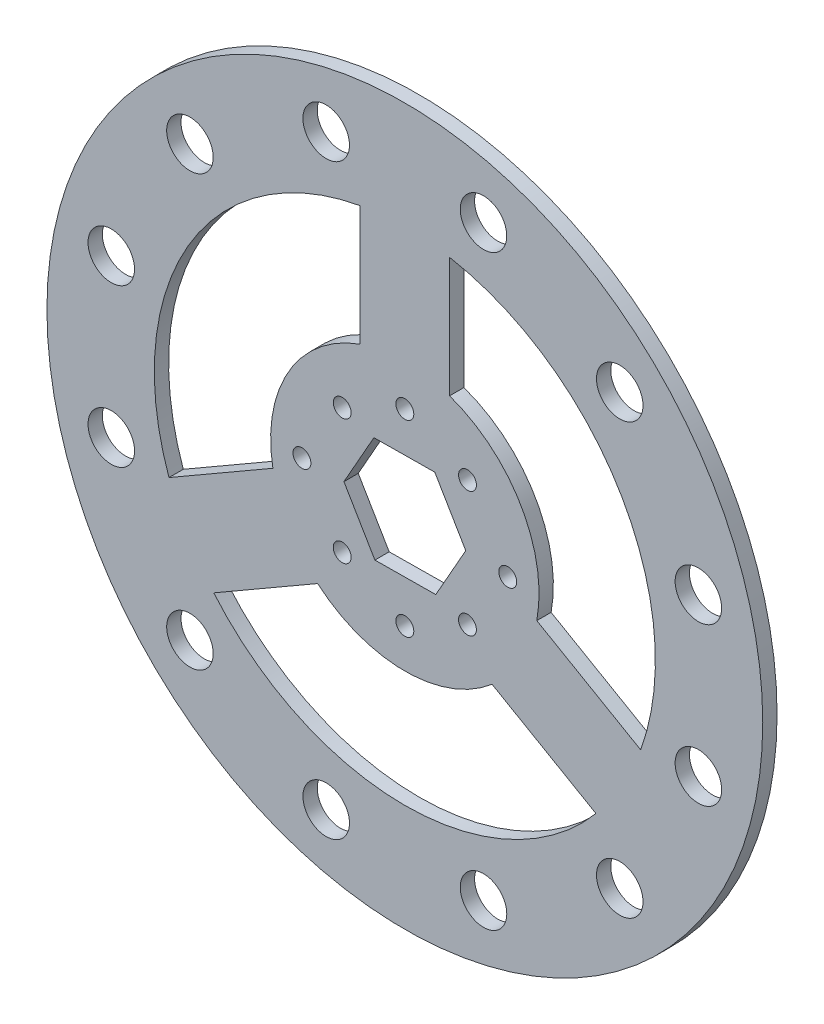
from build123d import *

# Parameters (mm, degrees)
SKETCH_8_R      = 40
SKETCH_8_R_2    = 1
SKETCH_8_R_3    = 2.6
EXTRUDE_3_DEPTH = 1.6


with BuildPart() as part:
    # 草图8 → 凸台-拉伸3 (new body)
    with BuildSketch(Plane.XY):
        with Locations((-53.736575471, -2.872479928)):
            Circle(SKETCH_8_R)
        with Locations((-53.736575471, 7.500392818)):
            Circle(SKETCH_8_R_2, mode=Mode.SUBTRACT)
        with Locations((-46.735230698, 4.127771963)):
            Circle(SKETCH_8_R_2, mode=Mode.SUBTRACT)
        with Locations((-42.236448471, -2.999480182)):
            Circle(SKETCH_8_R_2, mode=Mode.SUBTRACT)
        with Locations((-46.737760534, -9.869682445)):
            Circle(SKETCH_8_R_2, mode=Mode.SUBTRACT)
        with Locations((-53.736575471, -13.499607182)):
            Circle(SKETCH_8_R_2, mode=Mode.SUBTRACT)
        with Locations((-60.737570724, -9.872335788)):
            Circle(SKETCH_8_R_2, mode=Mode.SUBTRACT)
        with Locations((-65.236448471, -2.999480182)):
            Circle(SKETCH_8_R_2, mode=Mode.SUBTRACT)
        with Locations((-60.73580463, 4.12809202)):
            Circle(SKETCH_8_R_2, mode=Mode.SUBTRACT)
        with Locations((-62.528088914, 29.934409619)):
            Circle(SKETCH_8_R_3, mode=Mode.SUBTRACT)
        with Locations((-44.946804677, 29.93487656)):
            Circle(SKETCH_8_R_3, mode=Mode.SUBTRACT)
        with Locations((-29.720732426, 21.144638825)):
            Circle(SKETCH_8_R_3, mode=Mode.SUBTRACT)
        with Locations((-20.929685924, 5.919033515)):
            Circle(SKETCH_8_R_3, mode=Mode.SUBTRACT)
        with Locations((-20.929218983, -11.662250722)):
            Circle(SKETCH_8_R_3, mode=Mode.SUBTRACT)
        with Locations((-29.719456719, -26.888322973)):
            Circle(SKETCH_8_R_3, mode=Mode.SUBTRACT)
        with Locations((-44.945062029, -35.679369475)):
            Circle(SKETCH_8_R_3, mode=Mode.SUBTRACT)
        with Locations((-62.526346266, -35.679836416)):
            Circle(SKETCH_8_R_3, mode=Mode.SUBTRACT)
        with Locations((-77.752418517, -26.88959868)):
            Circle(SKETCH_8_R_3, mode=Mode.SUBTRACT)
        with Locations((-86.543465018, -11.66399337)):
            Circle(SKETCH_8_R_3, mode=Mode.SUBTRACT)
        with Locations((-86.543931959, 5.917290867)):
            Circle(SKETCH_8_R_3, mode=Mode.SUBTRACT)
        with Locations((-77.753694224, 21.143363118)):
            Circle(SKETCH_8_R_3, mode=Mode.SUBTRACT)
        with BuildLine():
            Line((-58.736575471, 24.6774747), (-58.736575471, 11.269655696))
            ThreePointArc((-58.736575471, 11.269655696), (-66.726956528, 4.627520072), (-68.484024185, -5.613420721))
            Line((-68.484024185, -5.613420721), (-80.095536052, -12.317330223))
            ThreePointArc((-80.095536052, -12.317330223), (-77.985286777, 11.127520072), (-58.736575471, 24.6774747))
        make_face(mode=Mode.SUBTRACT)
        Polygon((-57.085216568, -8.799480182), (-50.277963232, -8.735988313), (-46.929322134, -2.808988059), (-50.387934374, 3.054520326), (-57.195187711, 2.991028458), (-60.543828808, -2.935971796), align=None, mode=Mode.SUBTRACT)
        with BuildLine():
            Line((-48.736575471, 24.6774747), (-48.736575471, 11.269655696))
            ThreePointArc((-48.736575471, 11.269655696), (-40.746194414, 4.627520072), (-38.989126757, -5.613420721))
            Line((-38.989126757, -5.613420721), (-27.37761489, -12.317330223))
            ThreePointArc((-27.37761489, -12.317330223), (-29.487864165, 11.127520072), (-48.736575471, 24.6774747))
        make_face(mode=Mode.SUBTRACT)
        with BuildLine():
            Line((-32.37761489, -20.977584261), (-43.989126757, -14.273674759))
            ThreePointArc((-43.989126757, -14.273674759), (-53.736575471, -17.872479928), (-63.484024185, -14.273674759))
            Line((-63.484024185, -14.273674759), (-75.095536052, -20.977584261))
            ThreePointArc((-75.095536052, -20.977584261), (-53.736575471, -30.872479928), (-32.37761489, -20.977584261))
        make_face(mode=Mode.SUBTRACT)
    extrude(amount=EXTRUDE_3_DEPTH)


solid = part.part
